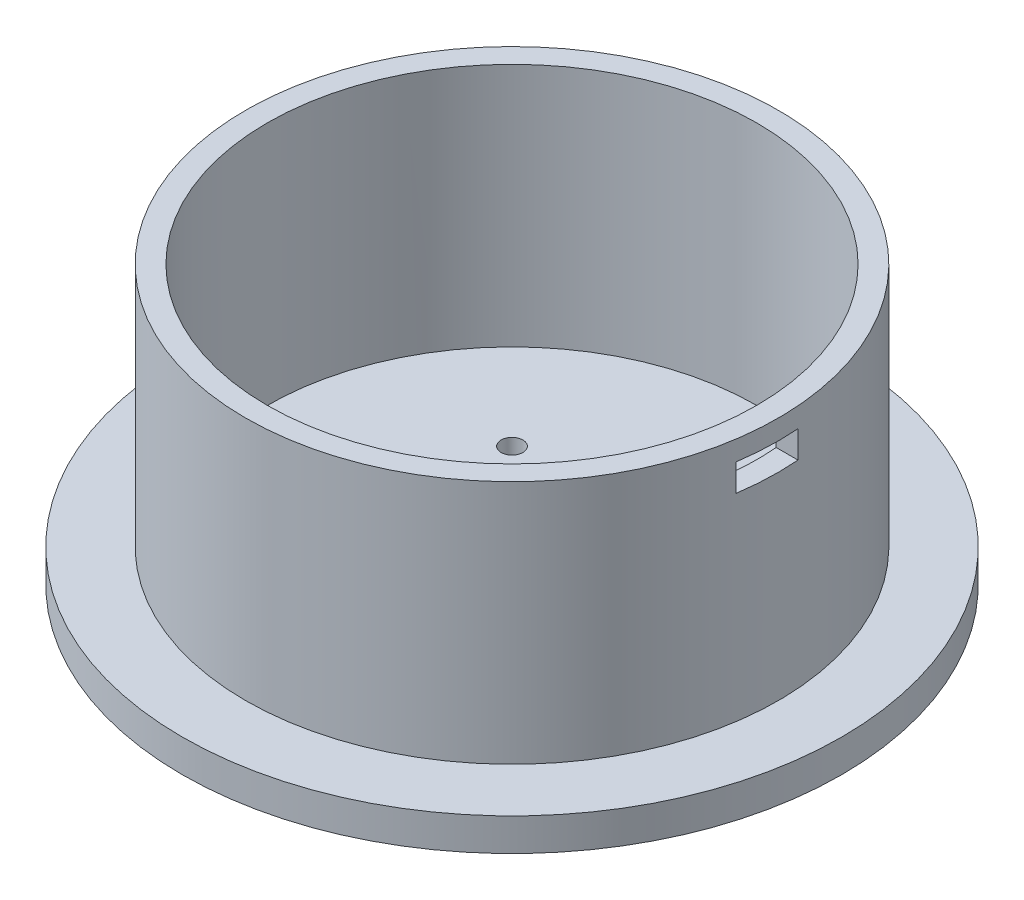
from build123d import *

# Parameters (mm, degrees)
SKETCH1_R           = 60.625
SKETCH1_R_2         = 45
BOSS_EXTRUDE1_DEPTH = 4
SKETCH2_R           = 49
SKETCH2_R_2         = 45
BOSS_EXTRUDE2_DEPTH = 45
SKETCH3_R           = 45
BOSS_EXTRUDE3_DEPTH = 4
BOSS_EXTRUDE7_START = 2
SKETCH4_R           = 60.625
SKETCH4_R_2         = 56.502019499
SKETCH4_R_3         = 46.502019499
BOSS_EXTRUDE7_DEPTH = 2
SKETCH5_R           = 2.5
SKETCH5_R_2         = 2
CUT_EXTRUDE1_DEPTH  = 10
SKETCH6_W           = 11
SKETCH6_H           = 5
CUT_EXTRUDE2_DEPTH  = 10


with BuildPart() as part:
    # Sketch1 → Boss-Extrude1 (new body)
    with BuildSketch(Plane(origin=(0, 0, 0), x_dir=(1, 0, 0), z_dir=(0, 1, 0))):
        with Locations(Location((-5.233283161, 2.275340505, 0), (0, 0, 270))):
            Circle(SKETCH1_R)
        with Locations(Location((-5.233283161, 2.275340505, 0), (0, 0, 270))):
            Circle(SKETCH1_R_2, mode=Mode.SUBTRACT)
    extrude(amount=BOSS_EXTRUDE1_DEPTH)

    # Sketch2 → Boss-Extrude2 (add)
    with BuildSketch(Plane(origin=(0, 4, 0), x_dir=(1, 0, 0), z_dir=(0, 1, 0))):
        with Locations(Location((-5.233283161, 2.275340505, 0), (0, 0, 90))):
            Circle(SKETCH2_R)
        with Locations(Location((-5.233283161, 2.275340505, 0), (0, 0, 270))):
            Circle(SKETCH2_R_2, mode=Mode.SUBTRACT)
    extrude(amount=BOSS_EXTRUDE2_DEPTH)

    # Sketch3 → Boss-Extrude3 (add)
    with BuildSketch(Plane(origin=(0, 0, 0), x_dir=(-1, 0, 0), z_dir=(0, -1, 0))):
        with Locations(Location((5.233283161, 2.275340505, 0), (0, 0, 90))):
            Circle(SKETCH3_R)
    extrude(amount=-BOSS_EXTRUDE3_DEPTH)

    # Sketch4 → Boss-Extrude7 (add)
    # profile 1 of 2: a face of its own
    with BuildSketch(Plane.XZ.offset(BOSS_EXTRUDE7_START)):
        with Locations(Location((-5.233283161, -2.275340505, 0), (0, 0, 270))):
            Circle(SKETCH4_R)
        with Locations(Location((-5.233283161, -2.275340505, 0), (0, 0, 270))):
            Circle(SKETCH4_R_2, mode=Mode.SUBTRACT)
    # profile 2 of 2: a face of its own
    with BuildSketch(Plane.XZ.offset(BOSS_EXTRUDE7_START)):
        with Locations(Location((-5.233283161, -2.275340505, 0), (0, 0, 90))):
            Circle(SKETCH4_R_3)
    extrude(amount=-BOSS_EXTRUDE7_DEPTH)

    # Sketch5 → Cut-Extrude1 (cut)
    with BuildSketch(Plane(origin=(0, -2, 0), x_dir=(-1, 0, 0), z_dir=(0, -1, 0))):
        with Locations(Location((5.233283161, 2.275340505, 0), (0, 0, 90))):
            Circle(SKETCH5_R)
        with Locations(Location((-10.766716839, -13.724659495, 0), (0, 0, 90))):
            Circle(SKETCH5_R_2)
        with Locations(Location((21.233283161, -13.724659495, 0), (0, 0, 90))):
            Circle(SKETCH5_R_2)
        with Locations(Location((21.233283161, 18.275340505, 0), (0, 0, 90))):
            Circle(SKETCH5_R_2)
        with Locations(Location((-10.766716839, 18.275340505, 0), (0, 0, 90))):
            Circle(SKETCH5_R_2)
    extrude(amount=-CUT_EXTRUDE1_DEPTH, mode=Mode.SUBTRACT)

    # Sketch6 → Cut-Extrude2 (cut)
    with BuildSketch(Plane(origin=(43.766716839, 0, 0), x_dir=(0, 0, -1), z_dir=(1, 0, 0))):
        with Locations((0.504292548, 42.858395169)):
            Rectangle(SKETCH6_W, SKETCH6_H)
    extrude(amount=-CUT_EXTRUDE2_DEPTH, mode=Mode.SUBTRACT)


solid = part.part
